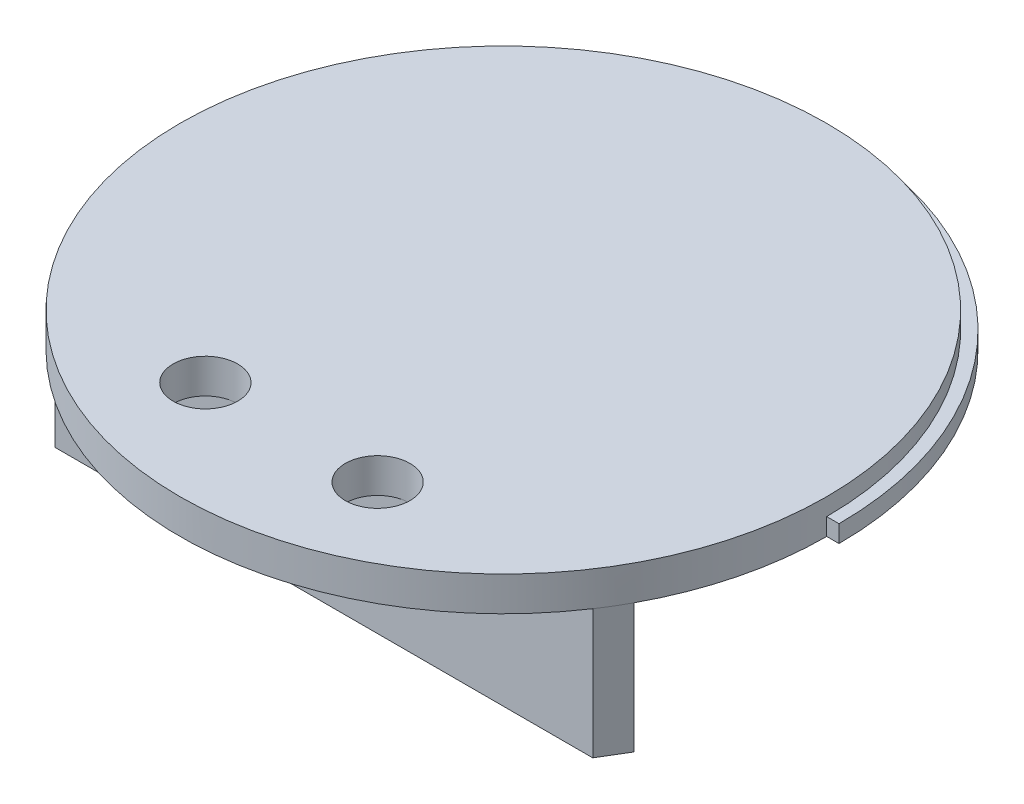
from build123d import *

# Parameters (mm, degrees)
BOSS_EXTRUDE1_DEPTH = 2.54
SKETCH2_R           = 47.6885
BOSS_EXTRUDE2_DEPTH = 2.54
SKETCH3_R           = 4.7625
CUT_EXTRUDE1_DEPTH  = 5.08
BOSS_EXTRUDE4_DEPTH = 19.05


with BuildPart() as part:
    # Sketch1 → Boss-Extrude1 (new body)
    with BuildSketch(Plane(origin=(0, 0, 0), x_dir=(1, 0, 0), z_dir=(0, 1, 0))):
        with BuildLine():
            Line((-49.5046, 0), (-47.6885, 0))
            ThreePointArc((-47.6885, 0), (0, -47.6885), (47.6885, 0))
            Line((47.6885, 0), (49.5046, 0))
            ThreePointArc((49.5046, 0), (0, 49.5046), (-49.5046, 0))
        make_face()
    extrude(amount=BOSS_EXTRUDE1_DEPTH)

    # Sketch2 → Boss-Extrude2 (add)
    with BuildSketch(Plane(origin=(0, 2.54, 0), x_dir=(1, 0, 0), z_dir=(0, 1, 0))):
        Circle(SKETCH2_R)
    extrude(amount=BOSS_EXTRUDE2_DEPTH)

    # Sketch3 → Cut-Extrude1 (cut)
    with BuildSketch(Plane.XZ):
        with Locations(Location((12.7, 31.235352443, 0), (0, 0, 270))):
            Circle(SKETCH3_R)
        with Locations(Location((-12.7, 31.235352443, 0), (0, 0, 270))):
            Circle(SKETCH3_R)
    extrude(amount=-CUT_EXTRUDE1_DEPTH, mode=Mode.SUBTRACT)

    # Sketch4 → Boss-Extrude4 (add)
    with BuildSketch(Plane.XZ):
        Polygon((41.959363096, 22.662852443), (-41.959363096, 22.662852443), (-39.665868398, 26.472852443), (39.665868398, 26.472852443), align=None)
    extrude(amount=BOSS_EXTRUDE4_DEPTH)


solid = part.part
